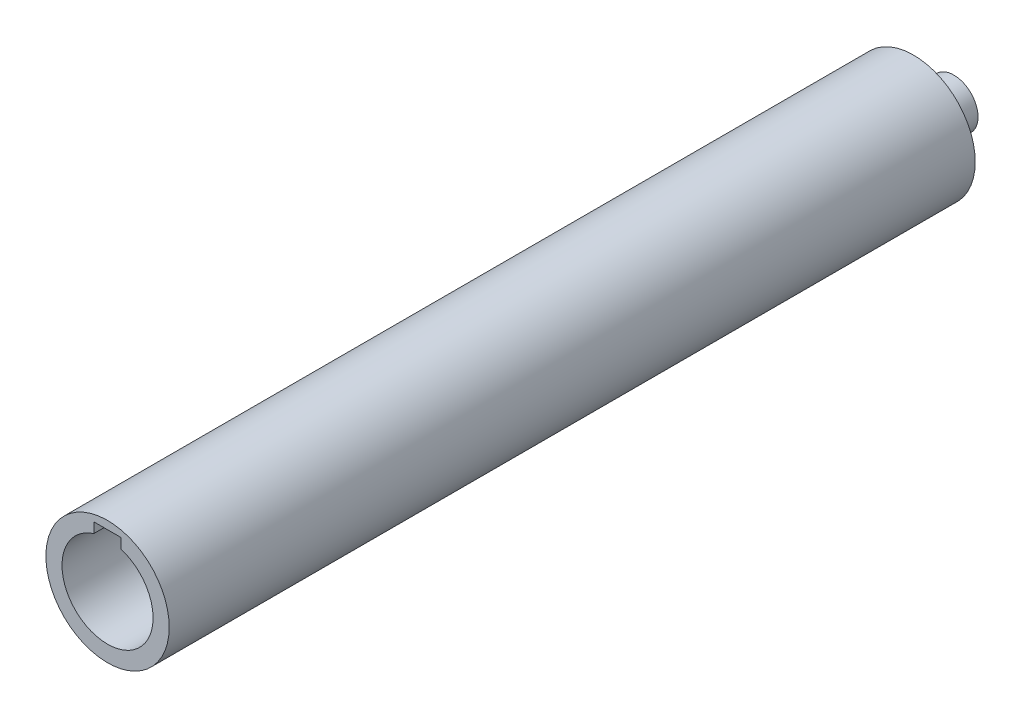
from build123d import *

# Parameters (mm, degrees)
SKETCH1_R           = 38.25
BOSS_EXTRUDE1_DEPTH = 250
CUT_EXTRUDE2_DEPTH  = 50
SKETCH4_R           = 35
SKETCH4_R_2         = 15
BOSS_EXTRUDE2_DEPTH = 50
BOSS_EXTRUDE3_START = 75
SKETCH5_R           = 15
BOSS_EXTRUDE3_DEPTH = 75


with BuildPart() as part:
    # Sketch1 → Boss-Extrude1 (new body)
    with BuildSketch(Plane.XY):
        Circle(SKETCH1_R)
    boss_extrude1 = extrude(amount=BOSS_EXTRUDE1_DEPTH)

    # Sketch3 → Cut-Extrude2 (cut)
    with BuildSketch(Plane.XY.offset(250)):
        with BuildLine():
            Line((-8.5, 26.940907557), (-8.5, 33.25))
            Line((-8.5, 33.25), (8.5, 33.25))
            Line((8.5, 33.25), (8.5, 26.940907557))
            ThreePointArc((8.5, 26.940907557), (0, -28.25), (-8.5, 26.940907557))
        make_face()
    cut_extrude2 = extrude(amount=-CUT_EXTRUDE2_DEPTH, mode=Mode.SUBTRACT)

    # Mirror1: Boss-Extrude1, Cut-Extrude2 across plane
    add(boss_extrude1.mirror(Plane.XY))
    add(cut_extrude2.mirror(Plane.XY), mode=Mode.SUBTRACT)

    # Sketch4 → Boss-Extrude2 (add)
    with BuildSketch(Plane(origin=(0, 0, -250), x_dir=(-1, 0, 0), z_dir=(0, 0, -1))):
        Circle(SKETCH4_R)
        Circle(SKETCH4_R_2, mode=Mode.SUBTRACT)
    extrude(amount=-BOSS_EXTRUDE2_DEPTH)

    # Sketch5 → Boss-Extrude3 (add)
    with BuildSketch(Plane(origin=(0, 0, -200), x_dir=(-1, 0, 0), z_dir=(0, 0, -1)).offset(BOSS_EXTRUDE3_START)):
        Circle(SKETCH5_R)
    extrude(amount=-BOSS_EXTRUDE3_DEPTH)


solid = part.part
